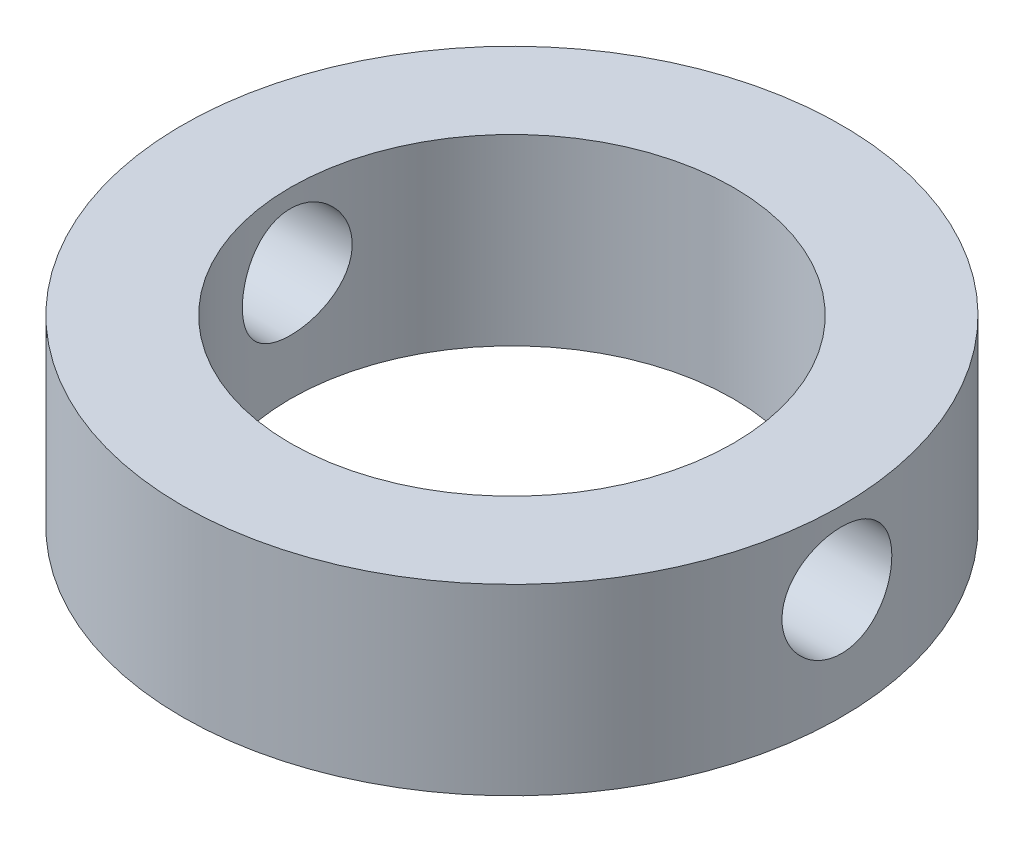
from build123d import *

# Parameters (mm, degrees)
COLLAR_STOCK_SKETCH_R             = 9
COLLAR_STOCK_DEPTH                = 5
AXLE_COLLAR_BORE_SKETCH_R         = 6.05
AXLE_COLLAR_BORE_DEPTH            = 5.2
POSITIVE_SPRING_PIN_BORE_SKETCH_R = 1.5
POSITIVE_SPRING_PIN_BORE_DEPTH    = 20


with BuildPart() as part:
    # Collar stock sketch → Collar stock (new body)
    with BuildSketch(Plane(origin=(0, -215, 0), x_dir=(1, 0, 0), z_dir=(0, 1, 0))):
        with Locations((-19.009182883, 53.244882879)):
            Circle(COLLAR_STOCK_SKETCH_R)
    extrude(amount=COLLAR_STOCK_DEPTH)

    # Axle collar bore sketch → Axle collar bore (cut)
    with BuildSketch(Plane(origin=(0, -215.1, 0), x_dir=(1, 0, 0), z_dir=(0, 1, 0))):
        with Locations((-19.009182883, 53.244882879)):
            Circle(AXLE_COLLAR_BORE_SKETCH_R)
    extrude(amount=AXLE_COLLAR_BORE_DEPTH, mode=Mode.SUBTRACT)

    # Positive spring pin bore sketch → Positive spring pin bore (cut)
    with BuildSketch(Plane(origin=(-29.009182883, 0, 0), x_dir=(0, 0, -1), z_dir=(1, 0, 0))):
        with Locations((53.244882879, -213)):
            Circle(POSITIVE_SPRING_PIN_BORE_SKETCH_R)
    extrude(amount=POSITIVE_SPRING_PIN_BORE_DEPTH, mode=Mode.SUBTRACT)


with BuildPart() as body_2:
    # Mirror1: mirrored copy
    add(part.part.mirror(Plane(origin=(0, 0, 0), x_dir=(0, 0, 1), z_dir=(0, -1, 0))))


solid = body_2.part
